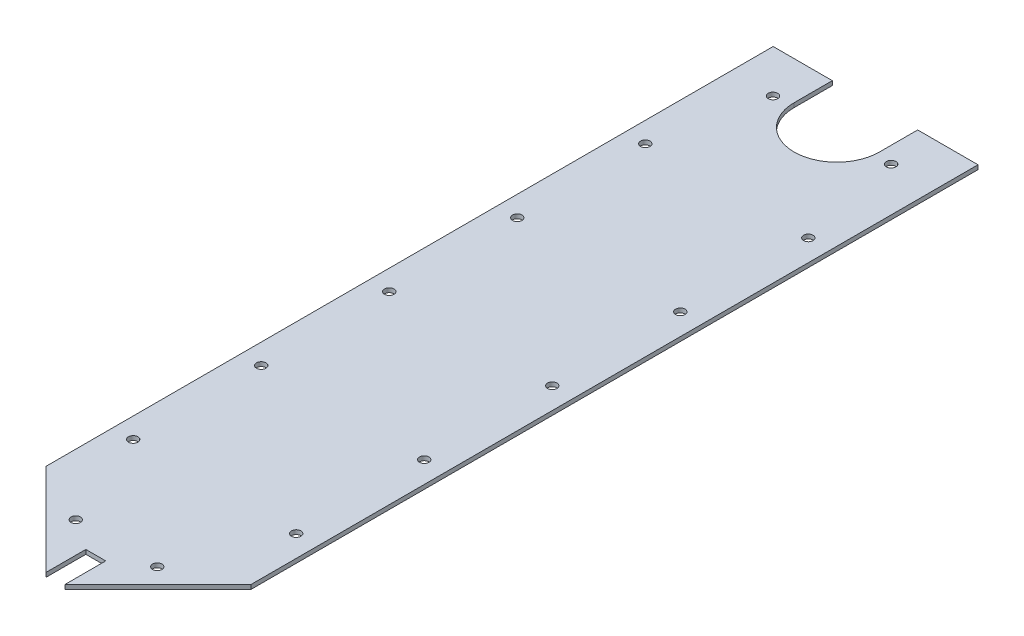
from build123d import *

# Parameters (mm, degrees)
BOSS_EXTRUDE2_DEPTH     = 3
CUT_EXTRUDE1_DEPTH      = 301.665110986
CUT_EXTRUDE2_DEPTH      = 301.665110986
CUT_EXTRUDE2_DEPTH_BACK = 301.665110986
SKETCH5_R               = 3.325


with BuildPart() as part:
    # Sketch3 → Boss-Extrude2 (new body)
    with BuildSketch(Plane(origin=(0, 0, 0), x_dir=(1, 0, 0), z_dir=(0, 1, 0))):
        with BuildLine():
            Line((-71.592001125, 291.800526166), (-30.005764519, 291.800526166))
            Line((-30.005764519, 291.800526166), (-30.005764519, 264.934819646))
            ThreePointArc((-30.005764519, 264.934819646), (0, 234.929055126), (30.005764519, 264.934819646))
            Line((30.005764519, 264.934819646), (30.005764519, 291.800526166))
            Line((30.005764519, 291.800526166), (72.408299895, 291.800526166))
            Line((72.408299895, 291.800526166), (72.408299895, -219.373421964))
            Line((72.408299895, -219.373421964), (0.408149385, -291.373572474))
            Line((0.408149385, -291.373572474), (-71.592001125, -219.373421964))
            Line((-71.592001125, -219.373421964), (-71.592001125, 291.800526166))
        make_face()
    extrude(amount=BOSS_EXTRUDE2_DEPTH)

    # Sketch4 → Cut-Extrude1 (cut, through all)
    with BuildSketch(Plane(origin=(0, 3, 0), x_dir=(1, 0, 0), z_dir=(0, 1, 0))):
        Polygon((-7, -283.965423089), (-7, -255.965423089), (7, -255.965423089), (7, -284.781721859), (0.408149385, -291.373572474), align=None)
    extrude(amount=-CUT_EXTRUDE1_DEPTH, mode=Mode.SUBTRACT)

    # Sketch5 → Cut-Extrude2 (cut, two sides: drawn at the far end of the back side and taken through both)
    with BuildSketch(Plane(origin=(0, 3, 0), x_dir=(1, 0, 0), z_dir=(0, 1, 0)).offset(-CUT_EXTRUDE2_DEPTH_BACK)):
        with Locations(Location((-28.65007526, -241.415105099, 0), (0, 0, 270))):
            Circle(SKETCH5_R)
        with Locations(Location((-57.30015051, -172.372698109, 0), (0, 0, 270))):
            Circle(SKETCH5_R)
        with Locations(Location((-57.30015051, -82.372698109, 0), (0, 0, 270))):
            Circle(SKETCH5_R)
        with Locations(Location((-57.30015051, 7.627301891, 0), (0, 0, 270))):
            Circle(SKETCH5_R)
        with Locations(Location((-57.30015051, 97.627301891, 0), (0, 0, 270))):
            Circle(SKETCH5_R)
        with Locations(Location((-57.30015051, 187.627301891, 0), (0, 0, 270))):
            Circle(SKETCH5_R)
        with Locations(Location((57.30015051, 187.627301891, 0), (0, 0, 90))):
            Circle(SKETCH5_R)
        with Locations(Location((57.30015051, 97.627301891, 0), (0, 0, 90))):
            Circle(SKETCH5_R)
        with Locations(Location((57.30015051, -82.372698109, 0), (0, 0, 90))):
            Circle(SKETCH5_R)
        with Locations(Location((57.30015051, -172.372698109, 0), (0, 0, 90))):
            Circle(SKETCH5_R)
        with Locations(Location((57.30015051, 7.627301891, 0), (0, 0, 90))):
            Circle(SKETCH5_R)
        with Locations(Location((28.65007526, -241.415105099, 0), (0, 0, 90))):
            Circle(SKETCH5_R)
        with Locations(Location((41.537257894, 261.609819636, 0), (0, 0, 270))):
            Circle(SKETCH5_R)
        with Locations(Location((-41.537257894, 261.609819636, 0), (0, 0, 90))):
            Circle(SKETCH5_R)
    extrude(amount=CUT_EXTRUDE2_DEPTH + CUT_EXTRUDE2_DEPTH_BACK, mode=Mode.SUBTRACT)


solid = part.part
